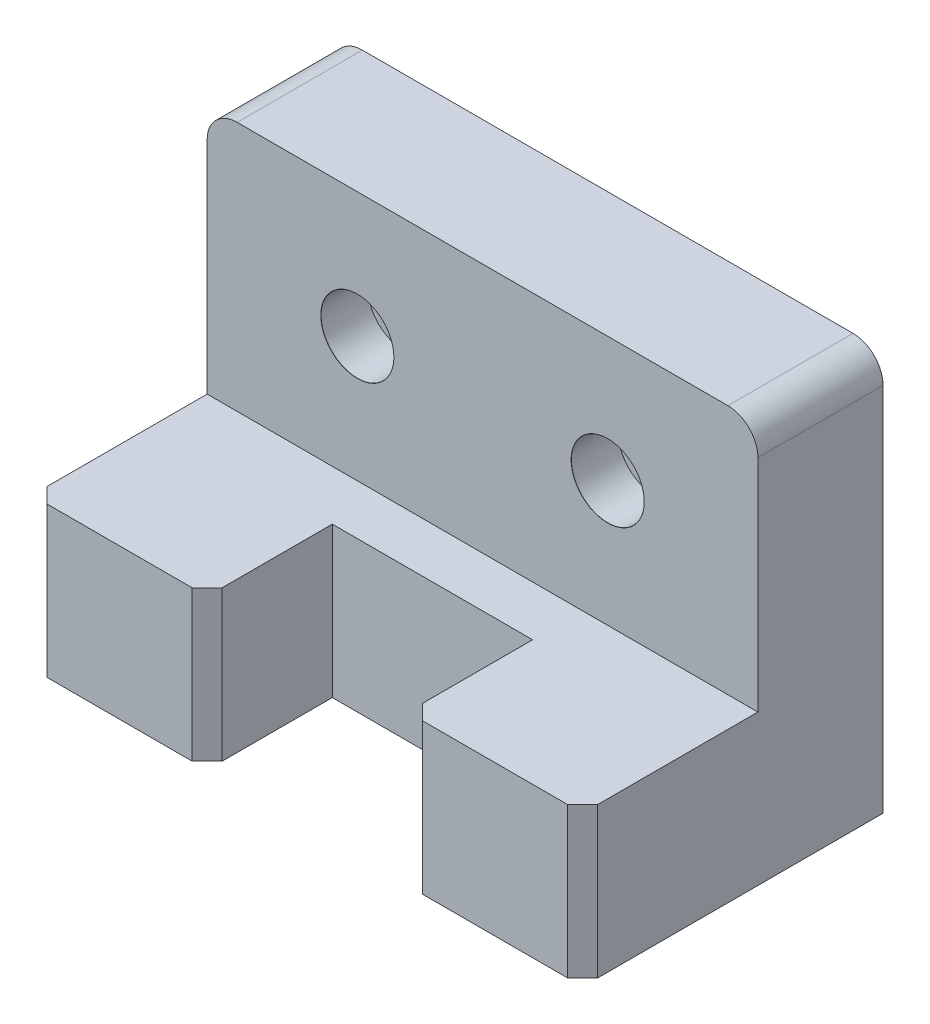
from build123d import *

# Parameters (mm, degrees)
BOSS_EXTRUDE1_DEPTH                    = 80
SKETCH2_W                              = 127.893941609
SKETCH2_H                              = 47.2063817
CUT_EXTRUDE1_DEPTH                     = 50
FILLET1_R                              = 6
CBORE_FOR_M6_HEX_HEAD_BOLT1_AT_2_COUNT = 2
CBORE_FOR_M6_HEX_HEAD_BOLT1_AT_2_PITCH = 50


with BuildPart() as part:
    # Sketch1 → Boss-Extrude1 (new body)
    with BuildSketch(Plane(origin=(0, 0, 0), x_dir=(1, 0, 0), z_dir=(0, 1, 0))):
        Polygon((-20, -57), (-20, -35), (20, -35), (20, -57), (23, -60), (52, -60), (55, -57), (55, 0), (-55, 0), (-55, -57), (-52, -60), (-23, -60), align=None)
    extrude(amount=BOSS_EXTRUDE1_DEPTH)

    # Sketch2 → Cut-Extrude1 (cut)
    with BuildSketch(Plane(origin=(0, 80, 0), x_dir=(1, 0, 0), z_dir=(0, 1, 0))):
        with Locations((-0.415915258, -48.60319085)):
            Rectangle(SKETCH2_W, SKETCH2_H)
    extrude(amount=-CUT_EXTRUDE1_DEPTH, mode=Mode.SUBTRACT)

    # Fillet1
    fillet1_edges = [part.edges().sort_by_distance(p)[0] for p in [
        (55, 80, 12.5),
        (-55, 80, 12.5),
    ]]
    fillet(fillet1_edges, radius=FILLET1_R)

    # Sketch3 → CBORE for M6 Hex Head Bolt1 (revolve, cut)
    with BuildSketch(Plane(origin=(-25, 55, 25), x_dir=(0, -1, 0), z_dir=(1, 0, 0))):
        Polygon((0, 0), (0, 25), (3.2, 25), (3.2, 9.38), (7.275, 9.38), (7.275, 0.025), (7.3, 0), align=None)
    cbore_for_m6_hex_head_bolt1 = revolve(axis=Axis((-25, 55, 31.35), (0, 0, -1)), mode=Mode.SUBTRACT)

    # CBORE for M6 Hex Head Bolt1 at 2: CBORE for M6 Hex Head Bolt1 ×2
    with Locations(*[(i * CBORE_FOR_M6_HEX_HEAD_BOLT1_AT_2_PITCH, 0, 0) for i in range(1, CBORE_FOR_M6_HEX_HEAD_BOLT1_AT_2_COUNT)]):
        add(cbore_for_m6_hex_head_bolt1, mode=Mode.SUBTRACT)


solid = part.part
